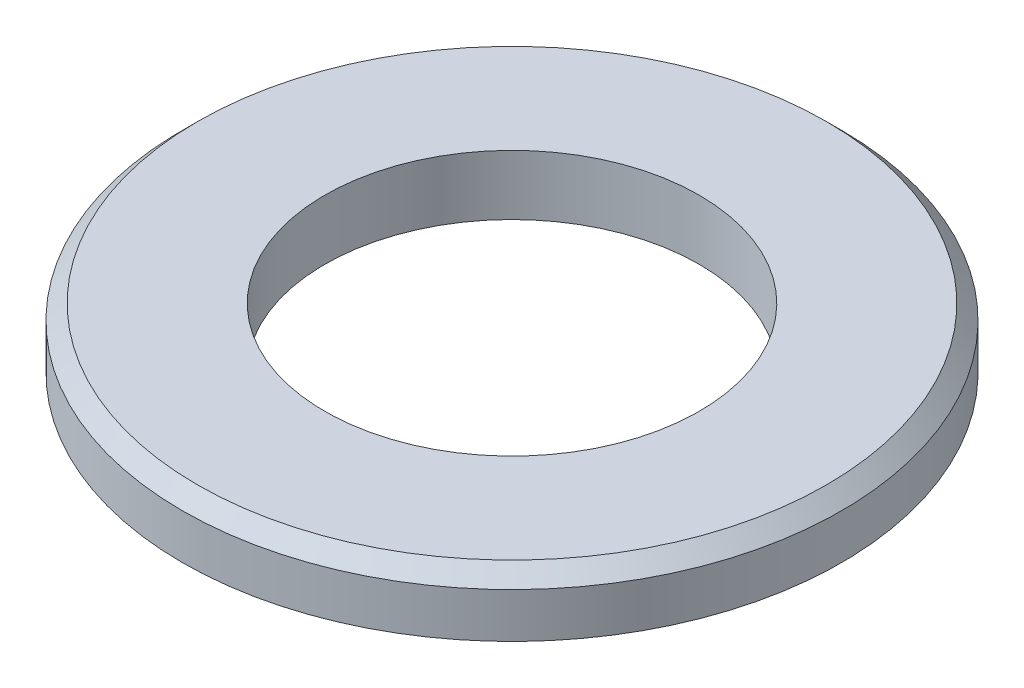
from build123d import *


with BuildPart() as part:
    # 草图1 → Revolve 484 (revolve)
    with BuildSketch(Plane.XY, mode=Mode.PRIVATE) as revolve_484_sk:
        Polygon((-21, 12.644507042), (-22, 11.644507042), (-22, 8.644507042), (-12.5, 8.644507042), (-12.5, 12.644507042), align=None)
    revolve(revolve_484_sk.sketch.rotate(Axis((0, 0, 0), (0, 1, 0)), 270), axis=Axis((0, 0, 0), (0, 1, 0)))


solid = part.part
